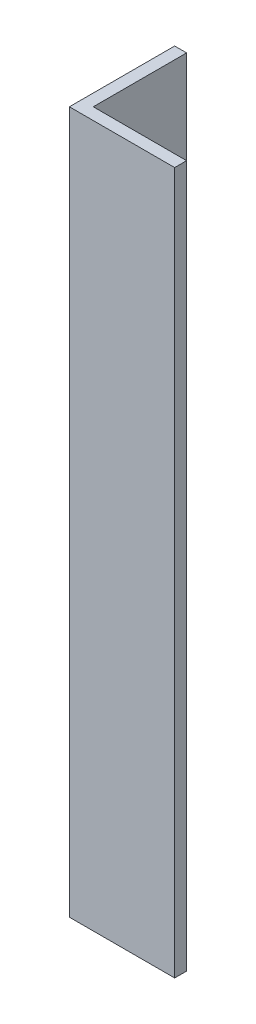
from build123d import *

# Parameters (mm, degrees)
BOSS_EXTRUDE1_DEPTH = 200


with BuildPart() as part:
    # Sketch1 → Boss-Extrude1 (new body)
    with BuildSketch(Plane(origin=(0, 0, 0), x_dir=(1, 0, 0), z_dir=(0, 1, 0))):
        Polygon((0, 0), (0, 30), (3.4, 30), (3.4, 3.4), (30, 3.4), (30, 0), align=None)
    extrude(amount=BOSS_EXTRUDE1_DEPTH)


solid = part.part
